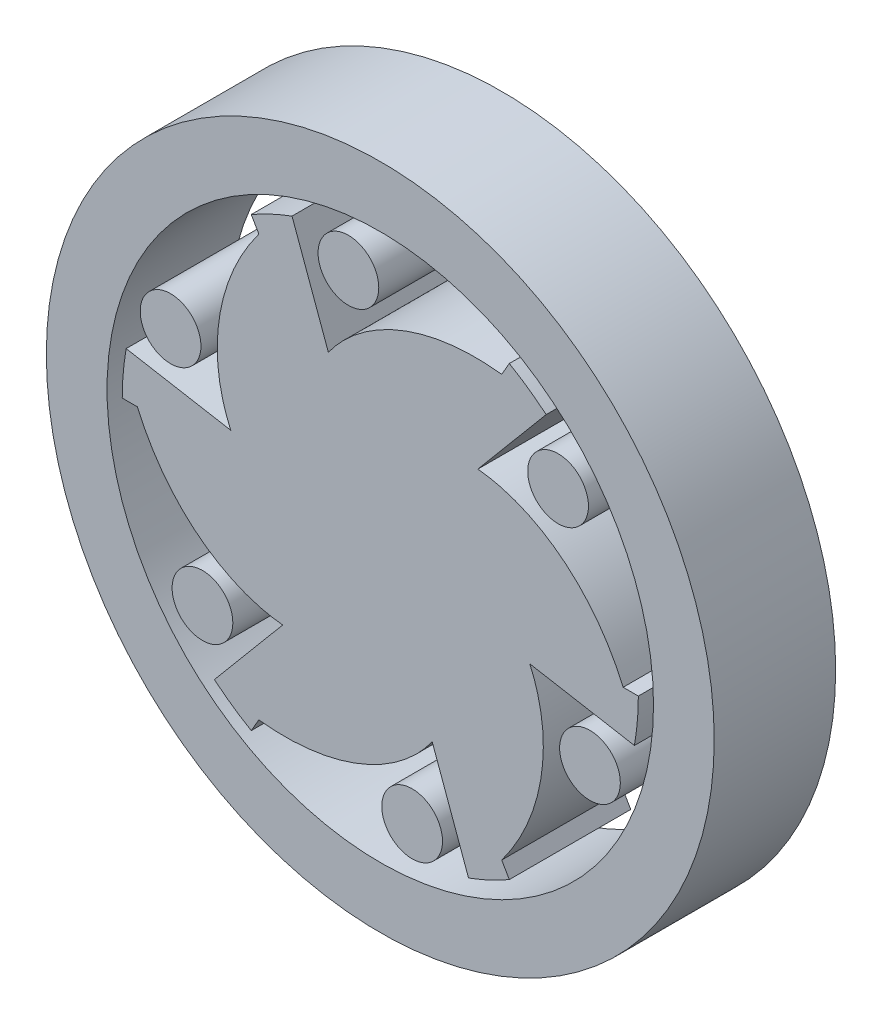
from build123d import *

# Parameters (mm, degrees)
SKETCH1_R           = 1
BOSS_EXTRUDE1_DEPTH = 4


with BuildPart() as part:
    # Sketch1 → Boss-Extrude1 (new body)
    with BuildSketch(Plane.XY):
        with BuildLine():
            Line((-4.5, -7.794228634), (-5.5, -9.526279442))
            ThreePointArc((-5.5, -9.526279442), (0, -11), (5.5, -9.526279442))
            Line((5.5, -9.526279442), (4.5, -7.794228634))
            ThreePointArc((4.5, -7.794228634), (0, -9), (-4.5, -7.794228634))
        make_face()
        with BuildLine():
            Line((-9, 0), (-11, 0))
            ThreePointArc((-11, 0), (-9.526279442, -5.5), (-5.5, -9.526279442))
            Line((-5.5, -9.526279442), (-4.5, -7.794228634))
            ThreePointArc((-4.5, -7.794228634), (-7.794228634, -4.5), (-9, 0))
        make_face()
        with Locations((-5.857151159, -4.594004093)):
            Circle(SKETCH1_R)
        with BuildLine():
            Line((-4, -6.92820323), (0, 0))
            Line((0, 0), (-8, 0))
            add(Edge.make_bspline(
                [(-8, 0), (-7.982478863, -0.040773537), (-7.946152884, -0.122846078), (-7.862546032, -0.306288496), (-7.782324618, -0.46313874), (-7.675998292, -0.665573655), (-7.576035773, -0.837906279), (-7.436881781, -1.067060658), (-7.293031605, -1.281237696), (-7.137920647, -1.495365786), (-6.943148702, -1.740750108), (-6.737447084, -1.979588204), (-6.48355522, -2.243974916), (-6.186754392, -2.515325031), (-5.914563044, -2.733867607), (-5.673247372, -2.907042051), (-5.468972543, -3.040700696), (-5.289080717, -3.149080172), (-5.106418283, -3.250632095), (-4.918204922, -3.345455421), (-4.729637412, -3.432759114), (-4.532646884, -3.513100754), (-4.341148417, -3.584878317), (-4.132869846, -3.649995098), (-3.945196105, -3.704604415), (-3.717224872, -3.754316878), (-3.550702642, -3.789107648), (-3.345403151, -3.815986422), (-3.258113074, -3.825976771), (-3.213938048, -3.830222216)],
                knots=[0.084693672, 0.084693672, 0.084693672, 0.084693672, 0.084693672, 0.112315151, 0.13993663, 0.167558081, 0.195179531, 0.222800999, 0.250422466, 0.305665355, 0.333286826, 0.360908297, 0.41615121, 0.471394134, 0.526637038, 0.572551518, 0.600172933, 0.627794439, 0.655415875, 0.683037362, 0.710658804, 0.738280261, 0.765901748, 0.793523168, 0.821144661, 0.848766106, 0.876387568, 0.90400906, 0.931630435, 0.931630435, 0.931630435, 0.931630435, 0.931630435], degree=4))
            Line((-3.213938048, -3.830222216), (-5.463694682, -6.511377767))
            ThreePointArc((-5.463694682, -6.511377767), (-4.875399709, -6.962792376), (-4.25, -7.361215932))
            Line((-4.25, -7.361215932), (-4, -6.92820323))
        make_face()
        with BuildLine():
            Line((4, -6.92820323), (0, 0))
            Line((0, 0), (-4, -6.92820323))
            add(Edge.make_bspline(
                [(-4, -6.92820323), (-3.955928513, -6.933416249), (-3.866688618, -6.942993299), (-3.666019397, -6.96230885), (-3.490072395, -6.97126019), (-3.261595453, -6.980396348), (-3.062369763, -6.979992579), (-2.794339253, -6.974058877), (-2.53693141, -6.956569489), (-2.273935565, -6.929303503), (-1.964040536, -6.883318212), (-1.654349869, -6.824594434), (-1.298438328, -6.736910985), (-0.915041821, -6.615548986), (-0.589682724, -6.489095652), (-0.31905142, -6.366697371), (-0.101162224, -6.256619503), (0.082643069, -6.15501835), (0.261920831, -6.047604003), (0.438146921, -5.932018114), (0.608037892, -5.812365707), (0.776111057, -5.681937725), (0.934021483, -5.551983969), (1.094553555, -5.404167826), (1.235683482, -5.268942257), (1.392721355, -5.09636961), (1.50611216, -4.969552513), (1.632039607, -4.805197326), (1.684336541, -4.734597076), (1.710100717, -4.698463104)],
                knots=[0.084693672, 0.084693672, 0.084693672, 0.084693672, 0.084693672, 0.112315151, 0.13993663, 0.167558081, 0.195179531, 0.222800999, 0.250422466, 0.305665355, 0.333286826, 0.360908297, 0.41615121, 0.471394134, 0.526637038, 0.572551518, 0.600172933, 0.627794439, 0.655415875, 0.683037362, 0.710658804, 0.738280261, 0.765901748, 0.793523168, 0.821144661, 0.848766106, 0.876387568, 0.90400906, 0.931630435, 0.931630435, 0.931630435, 0.931630435, 0.931630435], degree=4))
            Line((1.710100717, -4.698463104), (2.907171218, -7.987387277))
            ThreePointArc((2.907171218, -7.987387277), (3.592255225, -7.70361619), (4.25, -7.361215932))
            Line((4.25, -7.361215932), (4, -6.92820323))
        make_face()
        with BuildLine():
            Line((8.5, 0), (8, 0))
            Line((8, 0), (0, 0))
            Line((0, 0), (4, -6.92820323))
            add(Edge.make_bspline(
                [(4, -6.92820323), (4.02655035, -6.892642712), (4.079464267, -6.820147221), (4.196526635, -6.656020354), (4.292252223, -6.50812145), (4.414402839, -6.314822693), (4.513666011, -6.1420863), (4.642542528, -5.906998219), (4.756100196, -5.675331793), (4.863985082, -5.433937717), (4.979108166, -5.142568104), (5.083097216, -4.84500623), (5.185116893, -4.49293607), (5.271712571, -4.100223955), (5.32488032, -3.755228045), (5.354195952, -3.459655321), (5.367810319, -3.215918807), (5.371723786, -3.005938177), (5.368339114, -2.796971908), (5.356351842, -2.586562693), (5.337675304, -2.379606592), (5.308757941, -2.168836971), (5.2751699, -1.967105652), (5.227423402, -1.754172728), (5.180879587, -1.564337843), (5.109946226, -1.342052731), (5.056814802, -1.180444865), (4.977442758, -0.989210903), (4.942449615, -0.908620305), (4.924038765, -0.868240888)],
                knots=[0.084693672, 0.084693672, 0.084693672, 0.084693672, 0.084693672, 0.112315151, 0.13993663, 0.167558081, 0.195179531, 0.222800999, 0.250422466, 0.305665355, 0.333286826, 0.360908297, 0.41615121, 0.471394134, 0.526637038, 0.572551518, 0.600172933, 0.627794439, 0.655415875, 0.683037362, 0.710658804, 0.738280261, 0.765901748, 0.793523168, 0.821144661, 0.848766106, 0.876387568, 0.90400906, 0.931630435, 0.931630435, 0.931630435, 0.931630435, 0.931630435], degree=4))
            Line((4.924038765, -0.868240888), (8.370865901, -1.47600951))
            ThreePointArc((8.370865901, -1.47600951), (8.467654934, -0.740823813), (8.5, 0))
        make_face()
        with BuildLine():
            Line((4.5, -7.794228634), (5.5, -9.526279442))
            ThreePointArc((5.5, -9.526279442), (9.526279442, -5.5), (11, 0))
            Line((11, 0), (9, 0))
            ThreePointArc((9, 0), (7.794228634, -4.5), (4.5, -7.794228634))
        make_face()
        with BuildLine():
            Line((5.5, 9.526279442), (4.5, 7.794228634))
            ThreePointArc((4.5, 7.794228634), (7.794228634, 4.5), (9, 0))
            Line((9, 0), (11, 0))
            ThreePointArc((11, 0), (9.526279442, 5.5), (5.5, 9.526279442))
        make_face()
        with BuildLine():
            Line((-4.5, 7.794228634), (-5.5, 9.526279442))
            ThreePointArc((-5.5, 9.526279442), (-9.526279442, 5.5), (-11, 0))
            Line((-11, 0), (-9, 0))
            ThreePointArc((-9, 0), (-7.794228634, 4.5), (-4.5, 7.794228634))
        make_face()
        with BuildLine():
            Line((-8, 0), (0, 0))
            Line((0, 0), (-4, 6.92820323))
            add(Edge.make_bspline(
                [(-4, 6.92820323), (-4.02655035, 6.892642712), (-4.079464267, 6.820147221), (-4.196526635, 6.656020354), (-4.292252223, 6.50812145), (-4.414402839, 6.314822693), (-4.513666011, 6.1420863), (-4.642542528, 5.906998219), (-4.756100196, 5.675331793), (-4.863985082, 5.433937717), (-4.979108166, 5.142568104), (-5.083097216, 4.84500623), (-5.185116893, 4.49293607), (-5.271712571, 4.100223955), (-5.32488032, 3.755228045), (-5.354195952, 3.459655321), (-5.367810319, 3.215918807), (-5.371723786, 3.005938177), (-5.368339114, 2.796971908), (-5.356351842, 2.586562693), (-5.337675304, 2.379606592), (-5.308757941, 2.168836971), (-5.2751699, 1.967105652), (-5.227423402, 1.754172728), (-5.180879587, 1.564337843), (-5.109946226, 1.342052731), (-5.056814802, 1.180444865), (-4.977442758, 0.989210903), (-4.942449615, 0.908620305), (-4.924038765, 0.868240888)],
                knots=[0.084693672, 0.084693672, 0.084693672, 0.084693672, 0.084693672, 0.112315151, 0.13993663, 0.167558081, 0.195179531, 0.222800999, 0.250422466, 0.305665355, 0.333286826, 0.360908297, 0.41615121, 0.471394134, 0.526637038, 0.572551518, 0.600172933, 0.627794439, 0.655415875, 0.683037362, 0.710658804, 0.738280261, 0.765901748, 0.793523168, 0.821144661, 0.848766106, 0.876387568, 0.90400906, 0.931630435, 0.931630435, 0.931630435, 0.931630435, 0.931630435], degree=4))
            Line((-4.924038765, 0.868240888), (-8.370865901, 1.47600951))
            ThreePointArc((-8.370865901, 1.47600951), (-8.467654934, 0.740823813), (-8.5, 0))
            Line((-8.5, 0), (-8, 0))
        make_face()
        with Locations((-6.907099829, 2.775439652)):
            Circle(SKETCH1_R)
        with BuildLine():
            Line((8, 0), (0, 0))
            Line((0, 0), (4.25, 7.361215932))
            ThreePointArc((4.25, 7.361215932), (4.875399709, 6.962792376), (5.463694682, 6.511377767))
            Line((5.463694682, 6.511377767), (3.213938048, 3.830222216))
            add(Edge.make_bspline(
                [(8, 0), (7.982478863, 0.040773537), (7.946152884, 0.122846078), (7.862546032, 0.306288496), (7.782324618, 0.46313874), (7.675998292, 0.665573655), (7.576035773, 0.837906279), (7.436881781, 1.067060658), (7.293031605, 1.281237696), (7.137920647, 1.495365786), (6.943148702, 1.740750108), (6.737447084, 1.979588204), (6.48355522, 2.243974916), (6.186754392, 2.515325031), (5.914563044, 2.733867607), (5.673247372, 2.907042051), (5.468972543, 3.040700696), (5.289080717, 3.149080172), (5.106418283, 3.250632095), (4.918204922, 3.345455421), (4.729637412, 3.432759114), (4.532646884, 3.513100754), (4.341148417, 3.584878317), (4.132869846, 3.649995098), (3.945196105, 3.704604415), (3.717224872, 3.754316878), (3.550702642, 3.789107648), (3.345403151, 3.815986422), (3.258113074, 3.825976771), (3.213938048, 3.830222216)],
                knots=[0.084693672, 0.084693672, 0.084693672, 0.084693672, 0.084693672, 0.112315151, 0.13993663, 0.167558081, 0.195179531, 0.222800999, 0.250422466, 0.305665355, 0.333286826, 0.360908297, 0.41615121, 0.471394134, 0.526637038, 0.572551518, 0.600172933, 0.627794439, 0.655415875, 0.683037362, 0.710658804, 0.738280261, 0.765901748, 0.793523168, 0.821144661, 0.848766106, 0.876387568, 0.90400906, 0.931630435, 0.931630435, 0.931630435, 0.931630435, 0.931630435], degree=4))
        make_face()
        with Locations((6.907099829, -2.775439652)):
            Circle(SKETCH1_R)
        with BuildLine():
            Line((0, 0), (4, 6.92820323))
            add(Edge.make_bspline(
                [(4, 6.92820323), (3.955928513, 6.933416249), (3.866688618, 6.942993299), (3.666019397, 6.96230885), (3.490072395, 6.97126019), (3.261595453, 6.980396348), (3.062369763, 6.979992579), (2.794339253, 6.974058877), (2.53693141, 6.956569489), (2.273935565, 6.929303503), (1.964040536, 6.883318212), (1.654349869, 6.824594434), (1.298438328, 6.736910985), (0.915041821, 6.615548986), (0.589682724, 6.489095652), (0.31905142, 6.366697371), (0.101162224, 6.256619503), (-0.082643069, 6.15501835), (-0.261920831, 6.047604003), (-0.438146921, 5.932018114), (-0.608037892, 5.812365707), (-0.776111057, 5.681937725), (-0.934021483, 5.551983969), (-1.094553555, 5.404167826), (-1.235683482, 5.268942257), (-1.392721355, 5.09636961), (-1.50611216, 4.969552513), (-1.632039607, 4.805197326), (-1.684336541, 4.734597076), (-1.710100717, 4.698463104)],
                knots=[0.084693672, 0.084693672, 0.084693672, 0.084693672, 0.084693672, 0.112315151, 0.13993663, 0.167558081, 0.195179531, 0.222800999, 0.250422466, 0.305665355, 0.333286826, 0.360908297, 0.41615121, 0.471394134, 0.526637038, 0.572551518, 0.600172933, 0.627794439, 0.655415875, 0.683037362, 0.710658804, 0.738280261, 0.765901748, 0.793523168, 0.821144661, 0.848766106, 0.876387568, 0.90400906, 0.931630435, 0.931630435, 0.931630435, 0.931630435, 0.931630435], degree=4))
            Line((-1.710100717, 4.698463104), (-2.907171218, 7.987387277))
            ThreePointArc((-2.907171218, 7.987387277), (-3.592255225, 7.70361619), (-4.25, 7.361215932))
            Line((-4.25, 7.361215932), (-4, 6.92820323))
            Line((-4, 6.92820323), (0, 0))
        make_face()
        with Locations((-1.04994867, 7.369443744)):
            Circle(SKETCH1_R)
        with Locations((1.04994867, -7.369443744)):
            Circle(SKETCH1_R)
        with Locations((5.857151159, 4.594004093)):
            Circle(SKETCH1_R)
        with BuildLine():
            Line((5.5, 9.526279442), (4.5, 7.794228634))
            ThreePointArc((4.5, 7.794228634), (0, 9), (-4.5, 7.794228634))
            Line((-4.5, 7.794228634), (-5.5, 9.526279442))
            ThreePointArc((-5.5, 9.526279442), (0, 11), (5.5, 9.526279442))
        make_face()
    extrude(amount=BOSS_EXTRUDE1_DEPTH)


solid = part.part
